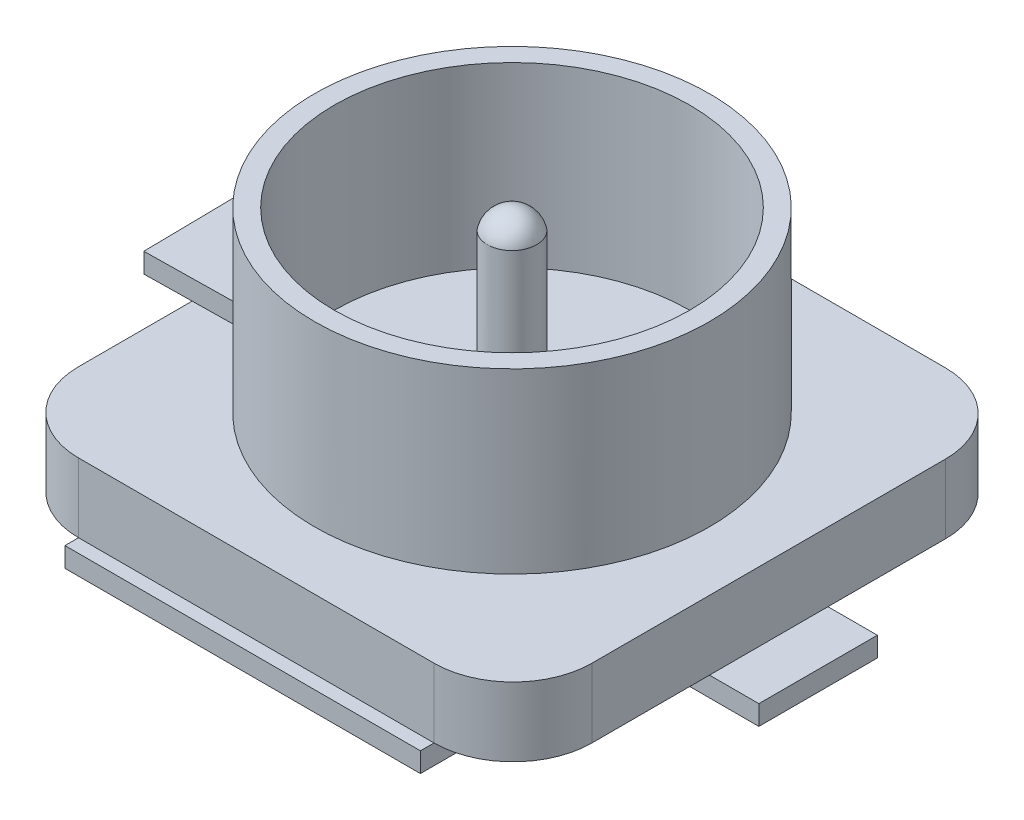
from build123d import *

# Parameters (mm, degrees)
BOSS_EXTRUDE2_DEPTH = 0.35
SKETCH2_R           = 1
SKETCH2_R_2         = 0.9
BOSS_EXTRUDE3_DEPTH = 0.9
SKETCH3_R           = 0.125
BOSS_EXTRUDE4_DEPTH = 0.8
DOME1_FACE_RADIUS   = 0.125
DOME1_HEIGHT        = 0.1
SKETCH4_W           = 1.8
SKETCH4_H           = 0.313763297
BOSS_EXTRUDE5_DEPTH = 0.1
SKETCH5_R           = 0.4
SKETCH5_W           = 1.55
SKETCH5_H           = 0.6
BOSS_EXTRUDE6_DEPTH = 0.1
BOSS_EXTRUDE7_DEPTH = 0.1


with BuildPart() as part:
    # Sketch1 → Boss-Extrude2 (new body)
    with BuildSketch(Plane(origin=(0, 0, 0), x_dir=(1, 0, 0), z_dir=(0, 1, 0))):
        with BuildLine():
            Line((-0.9, -1.295), (0.9, -1.295))
            ThreePointArc((0.9, -1.295), (1.182842712, -1.177842712), (1.3, -0.895))
            Line((1.3, -0.895), (1.3, 0.895))
            ThreePointArc((1.3, 0.895), (1.182842712, 1.177842712), (0.9, 1.295))
            Line((0.9, 1.295), (-0.9, 1.295))
            ThreePointArc((-0.9, 1.295), (-1.182842712, 1.177842712), (-1.3, 0.895))
            Line((-1.3, 0.895), (-1.3, -0.895))
            ThreePointArc((-1.3, -0.895), (-1.182842712, -1.177842712), (-0.9, -1.295))
        make_face()
    extrude(amount=BOSS_EXTRUDE2_DEPTH)

    # Sketch2 → Boss-Extrude3 (add)
    with BuildSketch(Plane(origin=(0, 0.35, 0), x_dir=(-1, 0, 0), z_dir=(0, 1, 0))):
        with Locations(Location((0, 0, 0), (0, 0, 270))):
            Circle(SKETCH2_R)
        with Locations(Location((0, 0, 0), (0, 0, 90))):
            Circle(SKETCH2_R_2, mode=Mode.SUBTRACT)
    extrude(amount=BOSS_EXTRUDE3_DEPTH)

    # Sketch3 → Boss-Extrude4 (add)
    with BuildSketch(Plane(origin=(0, 0.35, 0), x_dir=(-1, 0, 0), z_dir=(0, 1, 0))):
        with Locations(Location((0, 0, 0), (0, 0, 270))):
            Circle(SKETCH3_R)
    extrude(amount=BOSS_EXTRUDE4_DEPTH)

    # Dome1: a dome of height H over a round flat face of radius A is a cap of a sphere of radius (A * A + H * H) / (2 * H)
    dome1_r = (DOME1_FACE_RADIUS * DOME1_FACE_RADIUS + DOME1_HEIGHT * DOME1_HEIGHT) / (2 * DOME1_HEIGHT)
    dome1_base = Plane((0, 1.15, 0), z_dir=(0, 1, 0))
    with Locations(dome1_base.offset(DOME1_HEIGHT - dome1_r)):
        dome1_ball = Sphere(dome1_r, mode=Mode.PRIVATE)
    add(split(dome1_ball, bisect_by=dome1_base, keep=Keep.TOP, mode=Mode.PRIVATE))

    # Sketch4 → Boss-Extrude5 (add)
    with BuildSketch(Plane.XZ):
        with Locations((0, 1.206881649)):
            Rectangle(SKETCH4_W, SKETCH4_H)
        with Locations((0, -1.206881649)):
            Rectangle(SKETCH4_W, SKETCH4_H)
    extrude(amount=BOSS_EXTRUDE5_DEPTH)

    # Sketch5 → Boss-Extrude6 (add)
    with BuildSketch(Plane.XZ):
        Circle(SKETCH5_R)
        with Locations((0.775, 0)):
            Rectangle(SKETCH5_W, SKETCH5_H)
    extrude(amount=BOSS_EXTRUDE6_DEPTH)

    # Sketch6 → Boss-Extrude7 (add)
    with BuildSketch(Plane(origin=(0, 0.35, 0), x_dir=(1, 0, 0), z_dir=(0, 1, 0))):
        Polygon((-0.89535182, -0.313633184), (-0.904441652, 0.286366816), (-1.55, 0.276586788), (-1.540910168, -0.323413212), align=None)
    extrude(amount=BOSS_EXTRUDE7_DEPTH)


solid = part.part
